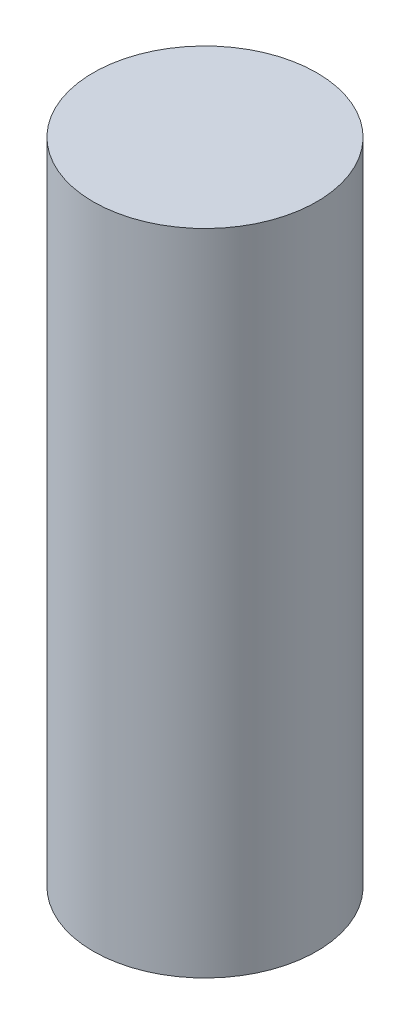
from build123d import *

# Parameters (mm, degrees)
SKETCH1_R           = 31
BOSS_EXTRUDE1_DEPTH = 180


with BuildPart() as part:
    # Sketch1 → Boss-Extrude1 (new body)
    with BuildSketch(Plane(origin=(0, 0, 0), x_dir=(1, 0, 0), z_dir=(0, 1, 0))):
        with Locations(Location((0, 0, 0), (0, 0, 90))):
            Circle(SKETCH1_R)
    extrude(amount=BOSS_EXTRUDE1_DEPTH)


solid = part.part
